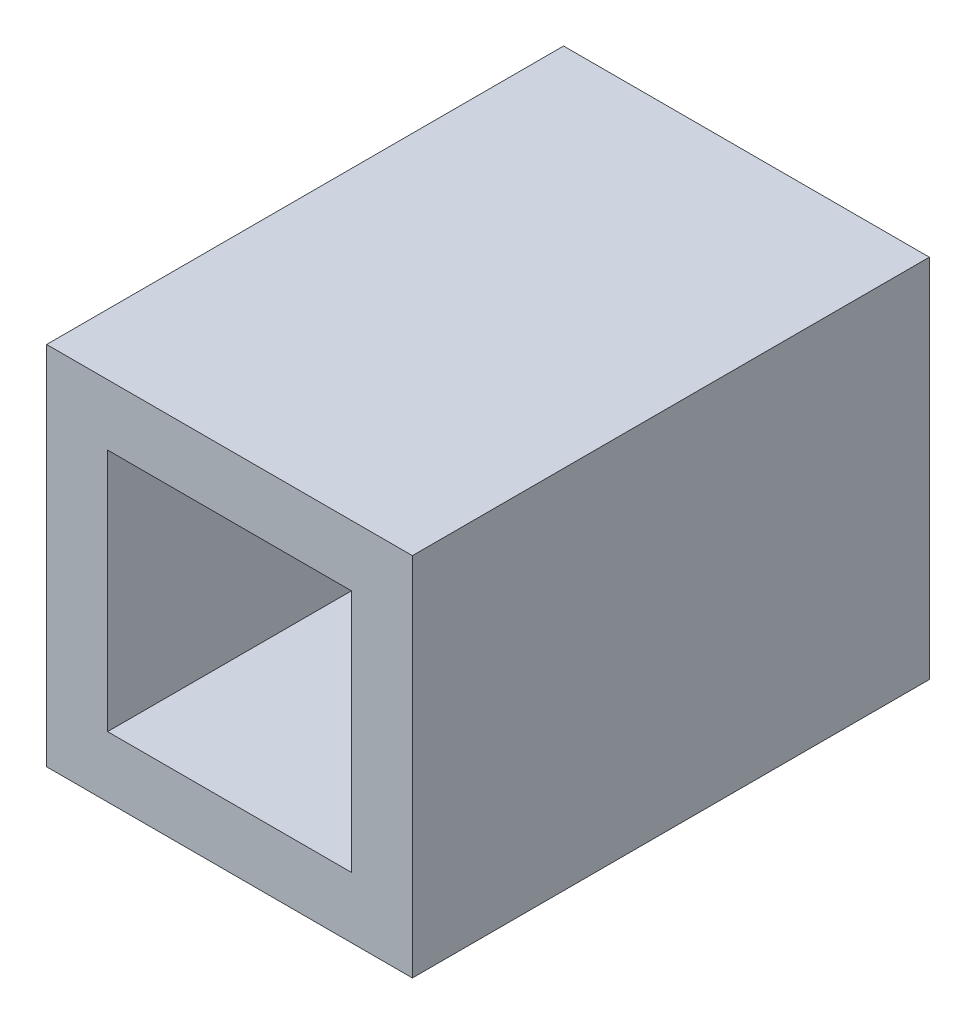
from build123d import *

# Parameters (mm, degrees)
SKETCH1_W           = 30
SKETCH1_H           = 30
SKETCH1_W_2         = 20
SKETCH1_H_2         = 20
BOSS_EXTRUDE1_DEPTH = 42.4


with BuildPart() as part:
    # Sketch1 → Boss-Extrude1 (new body)
    with BuildSketch(Plane.XY):
        Rectangle(SKETCH1_W, SKETCH1_H)
        Rectangle(SKETCH1_W_2, SKETCH1_H_2, mode=Mode.SUBTRACT)
    extrude(amount=BOSS_EXTRUDE1_DEPTH)


solid = part.part
